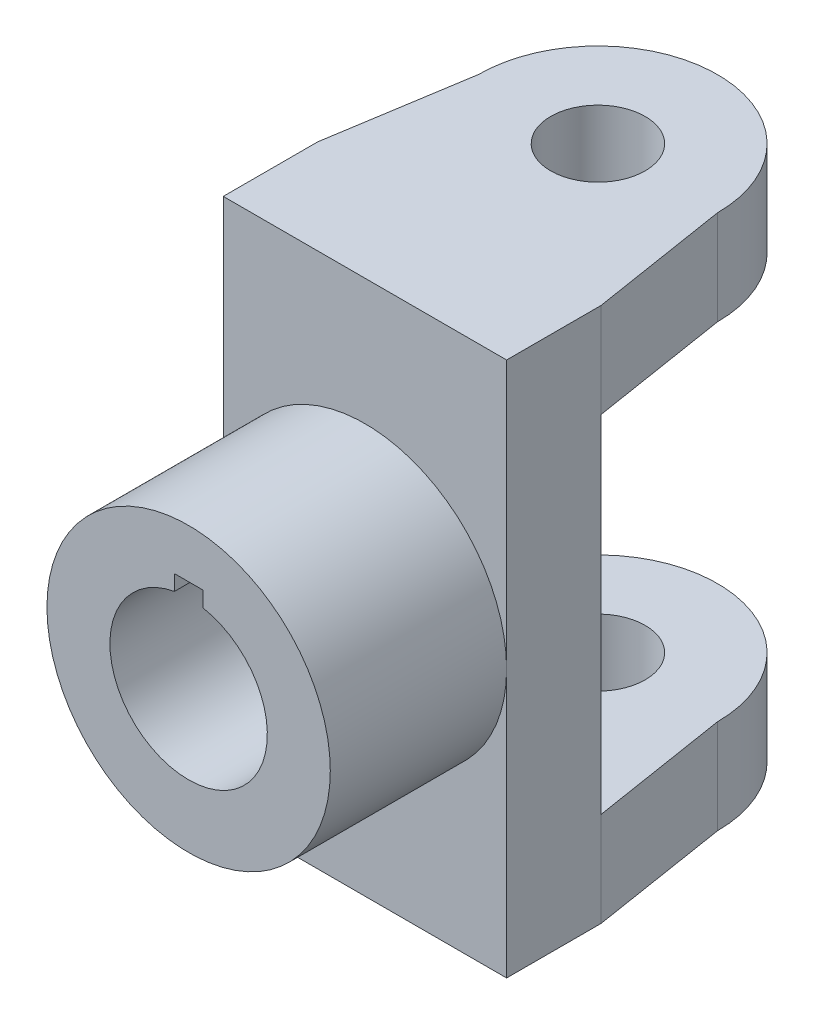
from build123d import *

# Parameters (mm, degrees)
SKETCH2_R           = 45
BOSS_EXTRUDE3_DEPTH = 56
SKETCH4_W           = 90
SKETCH4_H           = 170
BOSS_EXTRUDE4_DEPTH = 30
SKETCH6_R           = 15
BOSS_EXTRUDE5_DEPTH = 170
SKETCH11_W          = 132.381260595
SKETCH11_H          = 110
CUT_EXTRUDE3_DEPTH  = 130


with BuildPart() as part:
    # Sketch2 → Boss-Extrude3 (new body)
    with BuildSketch(Plane.XY):
        Circle(SKETCH2_R)
        with BuildLine():
            Line((-4.5, 29.491665255), (4.5, 29.491665255))
            Line((4.5, 29.491665255), (4.5, 24.591665255))
            ThreePointArc((4.5, 24.591665255), (0, -25), (-4.5, 24.591665255))
            Line((-4.5, 24.591665255), (-4.5, 29.491665255))
        make_face(mode=Mode.SUBTRACT)
    extrude(amount=-BOSS_EXTRUDE3_DEPTH)

    # Sketch4 → Boss-Extrude4 (add)
    with BuildSketch(Plane(origin=(0, 0, -56), x_dir=(-1, 0, 0), z_dir=(0, 0, -1))):
        Rectangle(SKETCH4_W, SKETCH4_H)
    extrude(amount=BOSS_EXTRUDE4_DEPTH)

    # Sketch6 → Boss-Extrude5 (add)
    with BuildSketch(Plane(origin=(0, 85, 0), x_dir=(1, 0, 0), z_dir=(0, 1, 0))):
        with BuildLine():
            Line((45, 86), (38, 130))
            ThreePointArc((38, 130), (0, 168), (-38, 130))
            Line((-38, 130), (-45, 86))
            Line((-45, 86), (45, 86))
        make_face()
        with Locations(Location((0, 130, 0), (0, 0, 270))):
            Circle(SKETCH6_R, mode=Mode.SUBTRACT)
    extrude(amount=-BOSS_EXTRUDE5_DEPTH)

    # Sketch11 → Cut-Extrude3 (cut, symmetric)
    with BuildSketch(Plane(origin=(0, 0, 0), x_dir=(0, 0, -1), z_dir=(1, 0, 0))):
        with Locations((152.190630298, 0)):
            Rectangle(SKETCH11_W, SKETCH11_H)
    extrude(amount=CUT_EXTRUDE3_DEPTH, both=True, mode=Mode.SUBTRACT)


solid = part.part
